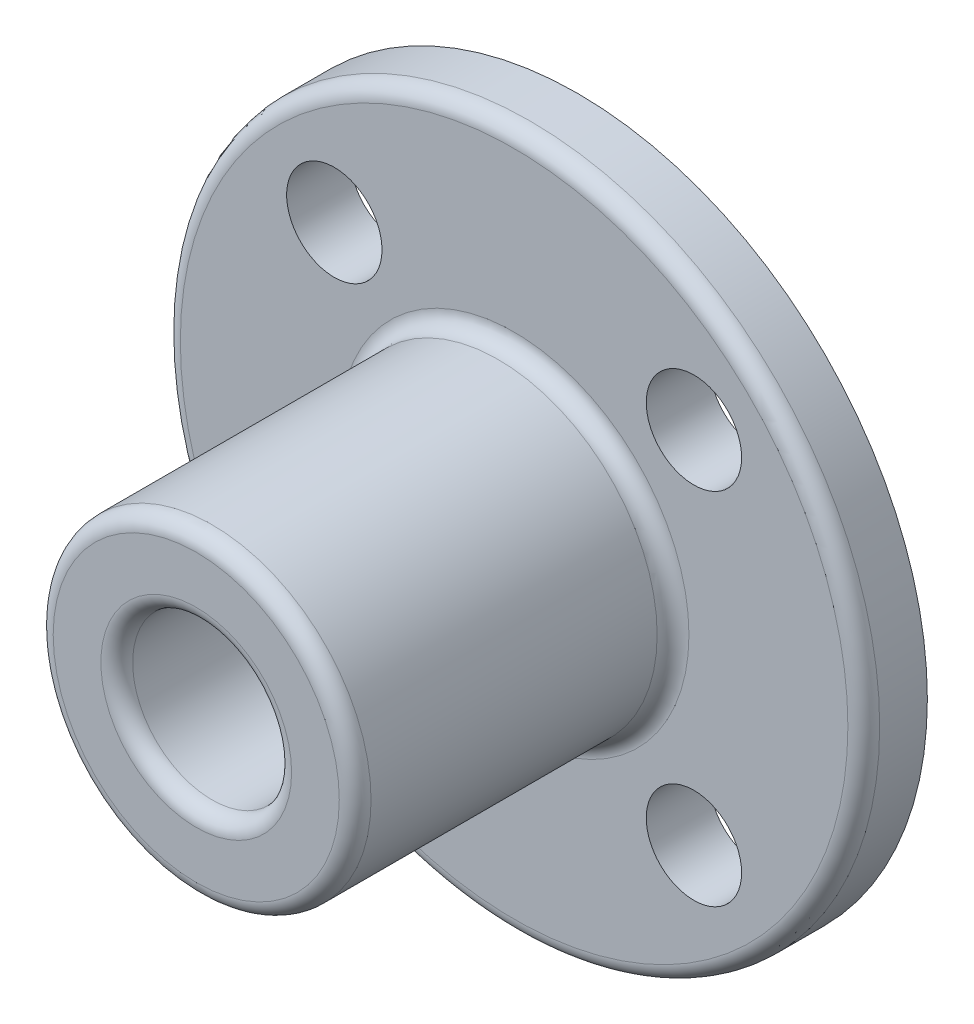
from build123d import *

# Parameters (mm, degrees)
SKETCH1_R           = 11
SKETCH1_R_2         = 2.5
SKETCH1_R_3         = 1.5
BOSS_EXTRUDE1_DEPTH = 2
SKETCH2_R           = 5
SKETCH2_R_2         = 2.5
BOSS_EXTRUDE2_DEPTH = 10
FILLET1_R           = 0.5


with BuildPart() as part:
    # Sketch1 → Boss-Extrude1 (new body)
    with BuildSketch(Plane.XY):
        Circle(SKETCH1_R)
        Circle(SKETCH1_R_2, mode=Mode.SUBTRACT)
        with Locations((-5.655999742, 5.657708628)):
            Circle(SKETCH1_R_3, mode=Mode.SUBTRACT)
        with Locations((5.655999742, 5.657708628)):
            Circle(SKETCH1_R_3, mode=Mode.SUBTRACT)
        with Locations((5.655999742, -5.657708628)):
            Circle(SKETCH1_R_3, mode=Mode.SUBTRACT)
        with Locations((-5.655999742, -5.657708628)):
            Circle(SKETCH1_R_3, mode=Mode.SUBTRACT)
    extrude(amount=BOSS_EXTRUDE1_DEPTH)

    # Sketch2 → Boss-Extrude2 (add)
    with BuildSketch(Plane.XY.offset(2)):
        Circle(SKETCH2_R)
        Circle(SKETCH2_R_2, mode=Mode.SUBTRACT)
    extrude(amount=BOSS_EXTRUDE2_DEPTH)

    # Fillet1
    fillet1_edges = [part.edges().sort_by_distance(p)[0] for p in [
        (-5, 0, 12),
        (-5, 0, 2),
        (-2.5, 0, 12),
        (-11, 0, 2),
    ]]
    fillet(fillet1_edges, radius=FILLET1_R)


solid = part.part
